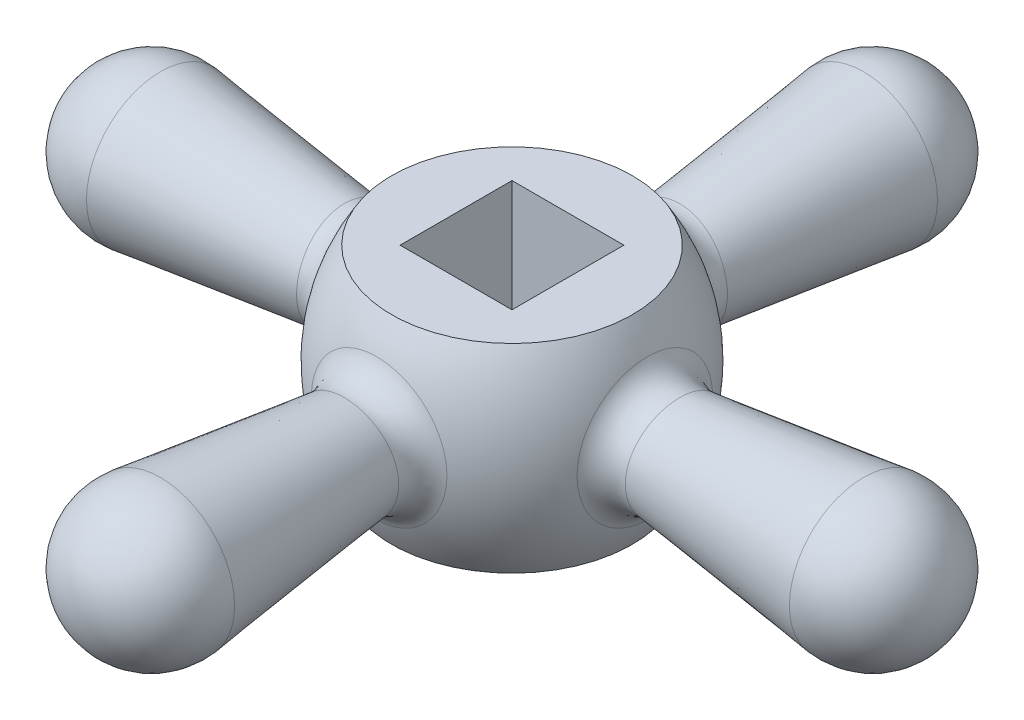
from build123d import *

# Parameters (mm, degrees)
FILLET1_R                = 2.5
CIRPATTERN1_COUNT        = 4
FILLET1_OF_CIRPATTERN1_R = 2.5
SKETCH3_W                = 9
SKETCH3_H                = 9
CUT_EXTRUDE1_DEPTH       = 11
SKETCH4_R                = 7.5
CUT_EXTRUDE2_DEPTH       = 3
CUT_EXTRUDE3_REACH       = 53.176
SKETCH5_R                = 2


with BuildPart() as part:
    # Sketch1 → Revolve1 (revolve)
    with BuildSketch(Plane(origin=(0, 0, 0), x_dir=(0, 0, -1), z_dir=(1, 0, 0)), mode=Mode.PRIVATE) as revolve1_sk:
        with BuildLine():
            Line((0, -8), (0, 8))
            Line((0, 8), (-9.68857754, 8))
            ThreePointArc((-9.68857754, 8), (-12, 0), (-9.68857754, -8))
            Line((-9.68857754, -8), (0, -8))
        make_face()
    revolve(revolve1_sk.sketch.rotate(Axis((0, 0, 0), (0, 1, 0)), 180), axis=Axis((0, 0, 0), (0, 1, 0)))

    # Sketch2 → Revolve2 (revolve)
    with BuildSketch(Plane.XY, mode=Mode.PRIVATE) as revolve2_sk:
        with BuildLine():
            Line((0, 0), (-35, 0))
            ThreePointArc((-35, 0), (-32.975720289, -4.493734325), (-28.26878394, -5.95527691))
            Line((-28.26878394, -5.95527691), (0, -2.484306687))
            Line((0, -2.484306687), (0, 0))
        make_face()
    revolve2 = revolve(revolve2_sk.sketch.rotate(Axis((0, 0, 0), (-1, 0, 0)), 341.200414784), axis=Axis((0, 0, 0), (-1, 0, 0)))

    # Fillet1
    fillet1_edges = [part.edges().sort_by_distance(p)[0] for p in [
        (-11.471875359, 3.685197146, 1.254513651),
    ]]
    fillet(fillet1_edges, radius=FILLET1_R)

    # CirPattern1: Revolve2 ×4 about axis
    cirpattern1_axis = Axis((0, 8, 0), (0, -1, 0))
    for i in range(1, CIRPATTERN1_COUNT):
        add(revolve2.rotate(cirpattern1_axis, i * 360 / CIRPATTERN1_COUNT))

    # Fillet1 of CirPattern1
    fillet1_of_cirpattern1_edges = [part.edges().sort_by_distance(p)[0] for p in [
        (-1.254513651, 3.685197146, -11.471875359),
        (11.471875359, 3.685197146, -1.254513651),
        (1.254513651, 3.685197146, 11.471875359),
    ]]
    fillet(fillet1_of_cirpattern1_edges, radius=FILLET1_OF_CIRPATTERN1_R)

    # Sketch3 → Cut-Extrude1 (cut)
    with BuildSketch(Plane(origin=(0, 8, 0), x_dir=(1, 0, 0), z_dir=(0, 1, 0))):
        Rectangle(SKETCH3_W, SKETCH3_H)
    extrude(amount=-CUT_EXTRUDE1_DEPTH, mode=Mode.SUBTRACT)

    # Sketch4 → Cut-Extrude2 (cut)
    with BuildSketch(Plane.XZ.offset(8)):
        with Locations(Location((0, 0, 0), (0, 0, 270))):
            Circle(SKETCH4_R)
    extrude(amount=-CUT_EXTRUDE2_DEPTH, mode=Mode.SUBTRACT)

    # Sketch5 → Cut-Extrude3 (cut, up to next)
    with BuildSketch(Plane.XZ.offset(5), mode=Mode.PRIVATE) as cut_extrude3_sk1:
        with Locations(Location((0, 0, 0), (0, 0, 270))):
            Circle(SKETCH5_R)
    cut_extrude3_tool1 = extrude(cut_extrude3_sk1.sketch, amount=-CUT_EXTRUDE3_REACH, mode=Mode.PRIVATE) & part.part
    add(cut_extrude3_tool1.solids().sort_by_distance((0, -5, 0))[0], mode=Mode.SUBTRACT)


solid = part.part
